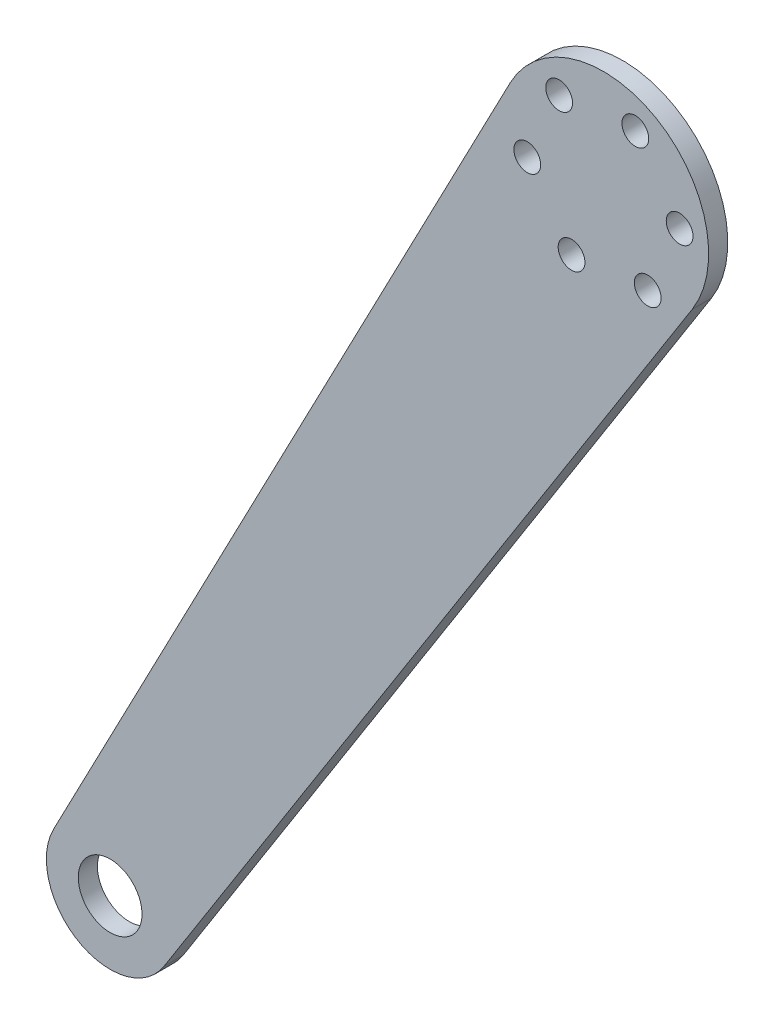
from build123d import *

# Parameters (mm, degrees)
SKETCH_1_R      = 5
SKETCH_1_R_2    = 2.1
EXTRUDE_1_DEPTH = 3


with BuildPart() as part:
    # 草图1 → 凸台-拉伸1 (new body)
    with BuildSketch(Plane(origin=(0, 0, 40.05672841), x_dir=(-1, 0, 0), z_dir=(0, 0, -1))):
        with BuildLine():
            Line((83.25633153, -79.958506894), (11.650116444, 57.209335041))
            ThreePointArc((11.650116444, 57.209335041), (-11.219662978, 63.867129513), (-16.911730575, 40.738069772))
            Line((-16.911730575, 40.738069772), (65.946121215, -89.941091905))
            ThreePointArc((65.946121215, -89.941091905), (79.387248151, -93.248956728), (83.25633153, -79.958506894))
        make_face()
        with Locations((74.391553652, -84.586218334)):
            Circle(SKETCH_1_R, mode=Mode.SUBTRACT)
        with Locations((-14.924086576, 50.696801373)):
            Circle(SKETCH_1_R_2, mode=Mode.SUBTRACT)
        with Locations((-7.977715561, 60.481888482)):
            Circle(SKETCH_1_R_2, mode=Mode.SUBTRACT)
        with Locations((3.969603961, 59.358698272)):
            Circle(SKETCH_1_R_2, mode=Mode.SUBTRACT)
        with Locations((8.970552467, 48.450420955)):
            Circle(SKETCH_1_R_2, mode=Mode.SUBTRACT)
        with Locations((2.024181452, 38.665333847)):
            Circle(SKETCH_1_R_2, mode=Mode.SUBTRACT)
        with Locations((-9.92313807, 39.788524056)):
            Circle(SKETCH_1_R_2, mode=Mode.SUBTRACT)
    extrude(amount=EXTRUDE_1_DEPTH)


solid = part.part
